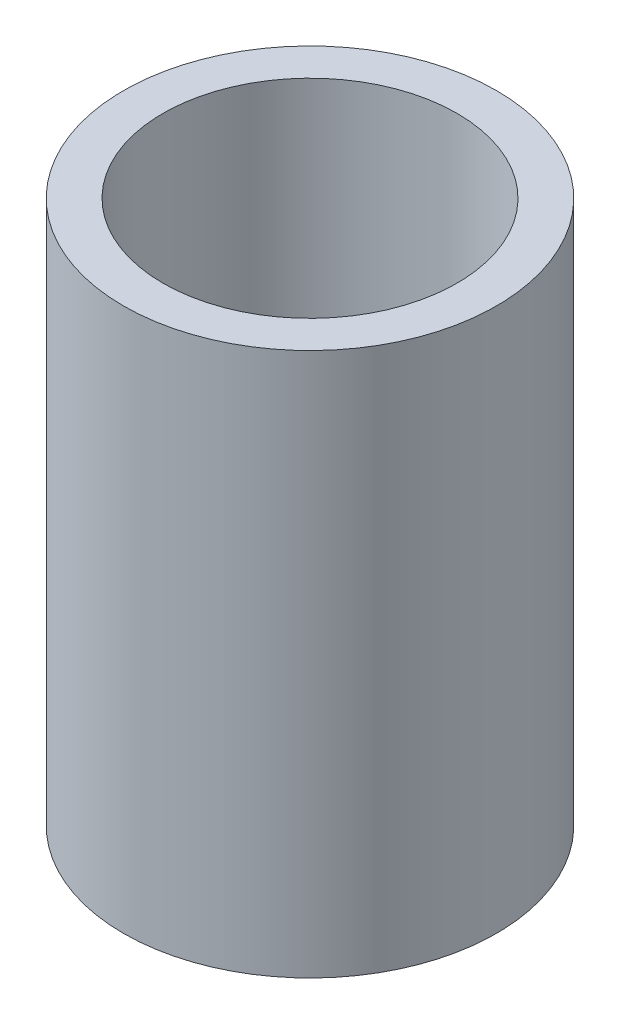
from build123d import *

# Parameters (mm, degrees)
SKETCH1_R           = 6.35
SKETCH1_R_2         = 5.0075
BOSS_EXTRUDE1_DEPTH = 18.5


with BuildPart() as part:
    # Sketch1 → Boss-Extrude1 (new body)
    with BuildSketch(Plane(origin=(0, 0, 0), x_dir=(1, 0, 0), z_dir=(0, 1, 0))):
        with Locations(Location((0, 0, 0), (0, 0, 270))):
            Circle(SKETCH1_R)
        with Locations(Location((0, 0, 0), (0, 0, 270))):
            Circle(SKETCH1_R_2, mode=Mode.SUBTRACT)
    extrude(amount=BOSS_EXTRUDE1_DEPTH)


solid = part.part
